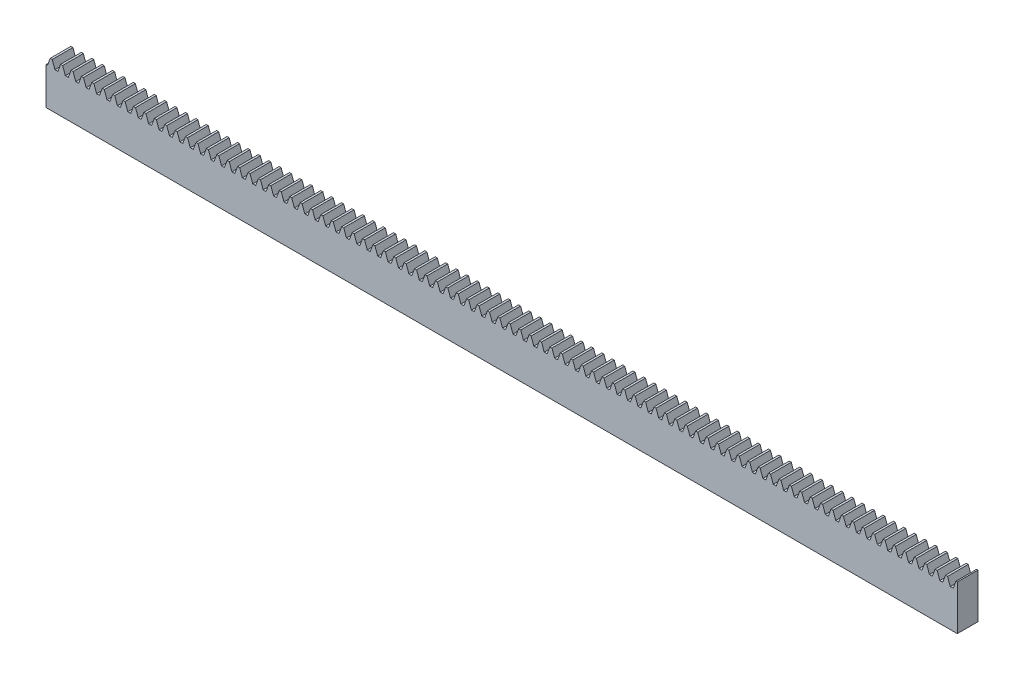
from build123d import *

# Parameters (mm, degrees)
BLANKSKE_W        = 220
BLANKSKE_H        = 10.8
BLANK_DEPTH       = 5
TOOTHCUTSIM_DEPTH = 221.321673922
TEETHCUTS_COUNT   = 89
TEETHCUTS_PITCH   = 2.51327412


with BuildPart() as part:
    # BlankSke → Blank (new body)
    with BuildSketch(Plane.XY):
        with Locations((110, 5.4)):
            Rectangle(BLANKSKE_W, BLANKSKE_H)
    extrude(amount=-BLANK_DEPTH)

    # TooCutSkeSim → ToothCutSim (cut, through all)
    with BuildSketch(Plane.XY):
        Polygon((0.354348296, 9), (-0.354348296, 9), (-1.018739561, 10.8254), (1.018739561, 10.8254), align=None)
    toothcutsim = extrude(amount=-TOOTHCUTSIM_DEPTH, mode=Mode.SUBTRACT)

    # TeethCuts: ToothCutSim ×89
    with Locations(*[(i * TEETHCUTS_PITCH, 0, 0) for i in range(1, TEETHCUTS_COUNT)]):
        add(toothcutsim, mode=Mode.SUBTRACT)


solid = part.part
